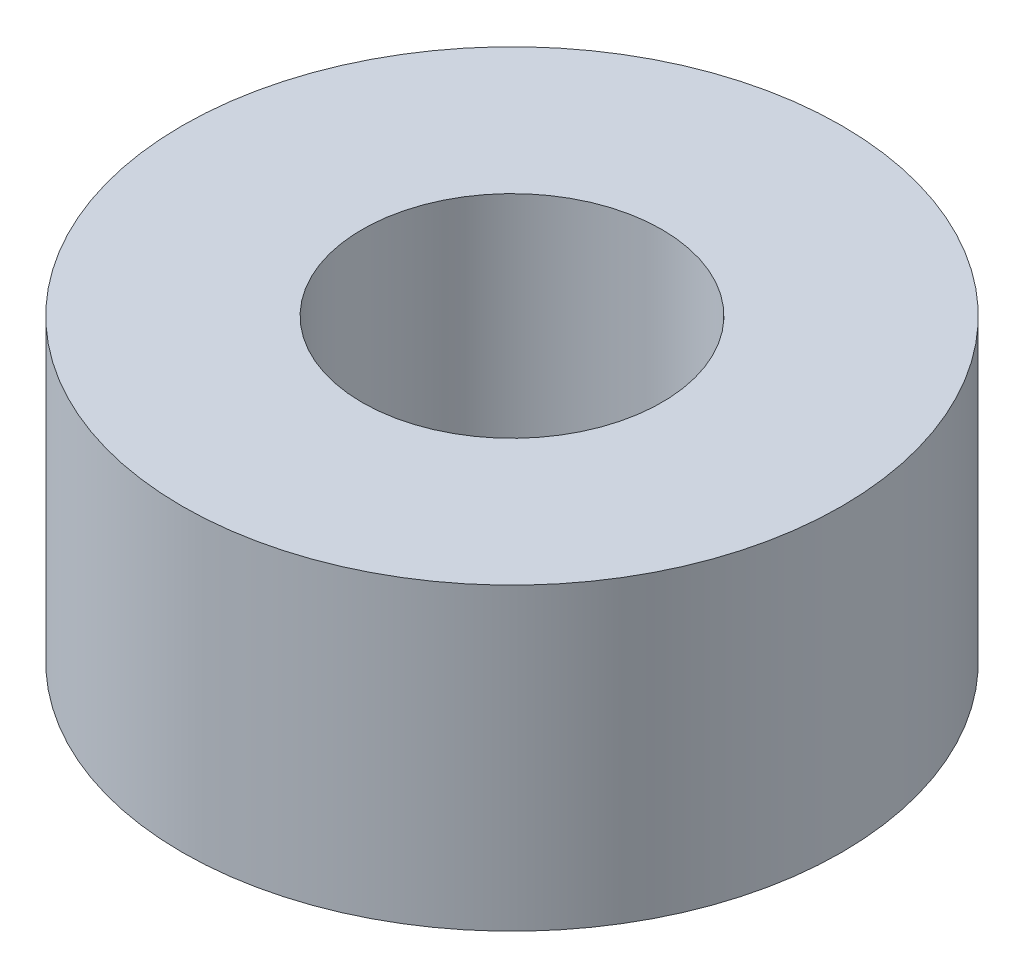
from build123d import *

# Parameters (mm, degrees)
SKETCH_1_R      = 5.5
SKETCH_1_R_2    = 2.5
EXTRUDE_1_DEPTH = 5


with BuildPart() as part:
    # 草图1 → 凸台-拉伸1 (new body)
    with BuildSketch(Plane(origin=(0, 0, 0), x_dir=(1, 0, 0), z_dir=(0, 1, 0))):
        with Locations(Location((0, 0, 0), (0, 0, 270))):
            Circle(SKETCH_1_R)
        with Locations(Location((0, 0, 0), (0, 0, 270))):
            Circle(SKETCH_1_R_2, mode=Mode.SUBTRACT)
    extrude(amount=EXTRUDE_1_DEPTH)


solid = part.part
